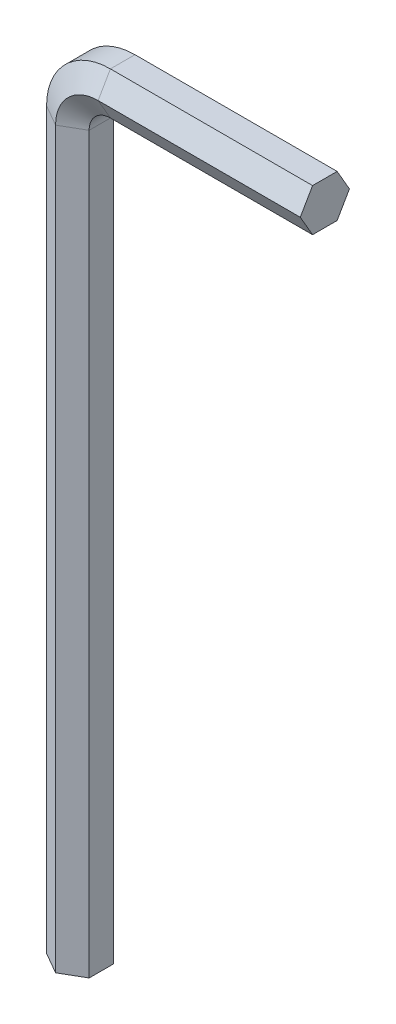
from build123d import *


with BuildPart() as part:
    # Sweep1: sweep along a path in Sketch1
    with BuildLine(Plane.XY) as sweep1_path:
        Line((0, 0), (0, 69))
        ThreePointArc((0, 69), (1.757359313, 73.242640687), (6, 75))
        Line((6, 75), (25, 75))
    # Sketch2 → Sweep1 (sweep)
    with BuildSketch(Plane(origin=(0, 0, 0), x_dir=(1, 0, 0), z_dir=(0, 1, 0))):
        Polygon((4, -1.154700538), (4, 1.154700538), (2, 2.309401077), (0, 1.154700538), (0, -1.154700538), (2, -2.309401077), align=None)
    sweep(path=sweep1_path.line)


solid = part.part
